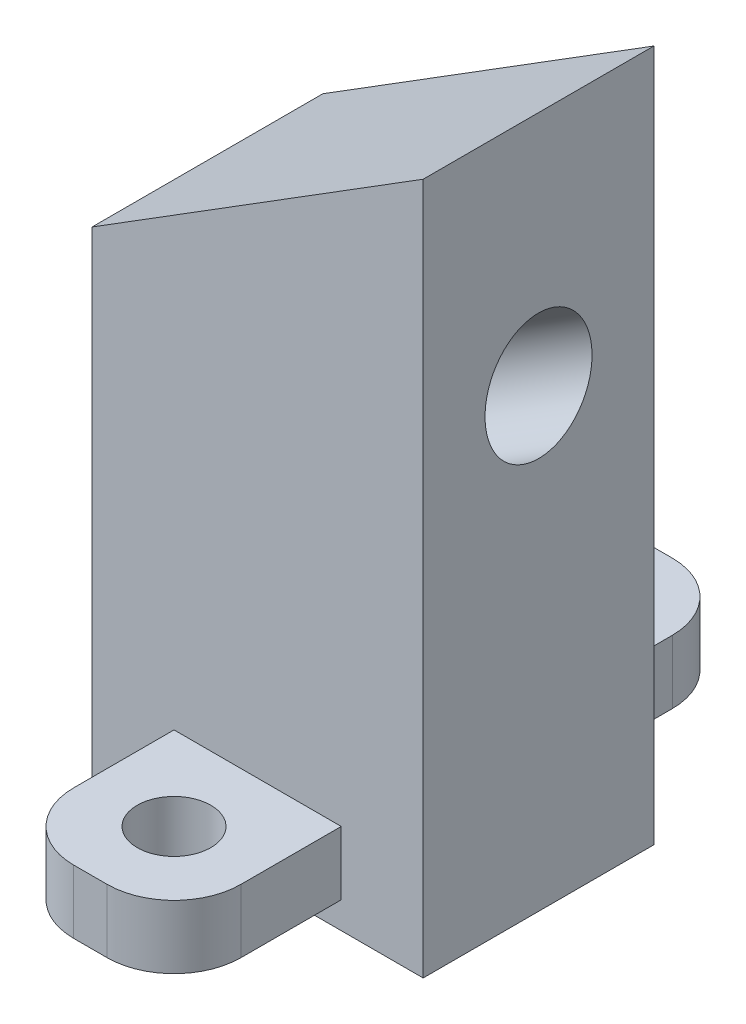
from build123d import *

# Parameters (mm, degrees)
EXTRUDE_1_DEPTH        = 1.5
SKETCH_3_R             = 1.1
CUT_EXTRUDE_1_DEPTH    = 5
EXTRUDE_2_DEPTH        = 6.9
SWEEP_1_PROFILE_R      = 1.6
CUT_EXTRUDE_START      = -7.8
CUT_EXTRUDE_5_DEPTH    = 7.8
EXTRUDE_START          = -0.8
SKETCH_81_W            = 5
SKETCH_81_H            = 5
SKETCH_81_R            = 1.1
EXTRUDE_8_DEPTH        = 1.9
FILLET_1_R             = 2
FILLET_1_OF_MIRROR_1_R = 2
SKETCH_83_W            = 6.9
SKETCH_83_H            = 14.5
EXTRUDE_10_DEPTH       = 1


with BuildPart() as part:
    # 草图2 → 凸台-拉伸1 (new body)
    with BuildSketch(Plane(origin=(0, 0, 0), x_dir=(1, 0, 0), z_dir=(0, 1, 0))):
        with BuildLine():
            Line((-4.95, 3.45), (7.45, 3.45))
            Line((7.45, 3.45), (7.45, -3.45))
            Line((7.45, -3.45), (-4.95, -3.45))
            ThreePointArc((-4.95, -3.45), (-6.717766953, -2.717766953), (-7.45, -0.95))
            Line((-7.45, -0.95), (-7.45, 0.95))
            ThreePointArc((-7.45, 0.95), (-6.717766953, 2.717766953), (-4.95, 3.45))
        make_face()
    extrude(amount=EXTRUDE_1_DEPTH)

    # 草图3 → 切除-拉伸1 (cut)
    with BuildSketch(Plane(origin=(0, 1.5, 0), x_dir=(1, 0, 0), z_dir=(0, 1, 0))):
        with Locations(Location((-4.95, 0, 0), (0, 0, 270))):
            Circle(SKETCH_3_R)
    extrude(amount=-CUT_EXTRUDE_1_DEPTH, mode=Mode.SUBTRACT)

    # 草图5 → 凸台-拉伸2 (add)
    with BuildSketch(Plane(origin=(0, 0, -3.45), x_dir=(-1, 0, 0), z_dir=(0, 0, -1))):
        Polygon((2.45, 1.5), (2.45, 14.5), (-7.45, 20.686206584), (-7.45, 1.5), align=None)
    extrude(amount=-EXTRUDE_2_DEPTH)

    # 切除-扫描1: sweep along a path in 草图7
    with BuildLine(Plane.XY) as sweep_1_path:
        Line((-6.203786906, 5.079303189), (11.626887116, 16.221144909))
    # 切除-扫描1 profile (on start of the path) → 切除-扫描1 (sweep, cut)
    with BuildSketch(Plane(origin=(-6.203786906, 5.079303189, 0), x_dir=(-0.529919264233206, 0.8480480961564254, 0), z_dir=(0.8480480961564254, 0.529919264233206, 0))):
        Circle(SWEEP_1_PROFILE_R)
    sweep(path=sweep_1_path.line, mode=Mode.SUBTRACT)

    # 草图80 → 切除-拉伸5 (cut)
    with BuildSketch(Plane(origin=(0, 1.5, 0), x_dir=(1, 0, 0), z_dir=(0, 1, 0)).offset(CUT_EXTRUDE_START)):
        with BuildLine():
            Line((-4.95, -3.45), (-2.45, -3.45))
            Line((-2.45, -3.45), (-2.45, 3.45))
            Line((-2.45, 3.45), (-4.95, 3.45))
            ThreePointArc((-4.95, 3.45), (-6.717766953, 2.717766953), (-7.45, 0.95))
            Line((-7.45, 0.95), (-7.45, -0.95))
            ThreePointArc((-7.45, -0.95), (-6.717766953, -2.717766953), (-4.95, -3.45))
        make_face()
    extrude(amount=CUT_EXTRUDE_5_DEPTH, mode=Mode.SUBTRACT)

    # 草图81 → 凸台-拉伸8 (add)
    with BuildSketch(Plane.XZ.offset(EXTRUDE_START)):
        with Locations((2.5, 5.95)):
            Rectangle(SKETCH_81_W, SKETCH_81_H)
        with Locations(Location((2.5, 5.95, 0), (0, 0, 270))):
            Circle(SKETCH_81_R, mode=Mode.SUBTRACT)
    extrude_8 = extrude(amount=-EXTRUDE_8_DEPTH)

    # 圆角1
    fillet_1_edges = [part.edges().sort_by_distance(p)[0] for p in [
        (5, 1.75, 8.45),
        (0, 1.75, 8.45),
    ]]
    fillet(fillet_1_edges, radius=FILLET_1_R)

    # 镜向1: 凸台-拉伸8 across plane
    add(extrude_8.mirror(Plane.XY))

    # 圆角1 of 镜向1
    fillet_1_of_mirror_1_edges = [part.edges().sort_by_distance(p)[0] for p in [
        (5, 1.75, -8.45),
        (0, 1.75, -8.45),
    ]]
    fillet(fillet_1_of_mirror_1_edges, radius=FILLET_1_OF_MIRROR_1_R)

    # 草图83 → 凸台-拉伸10 (add)
    with BuildSketch(Plane.ZY.offset(2.45)):
        with Locations((0, 7.25)):
            Rectangle(SKETCH_83_W, SKETCH_83_H)
    extrude(amount=-EXTRUDE_10_DEPTH)


solid = part.part
